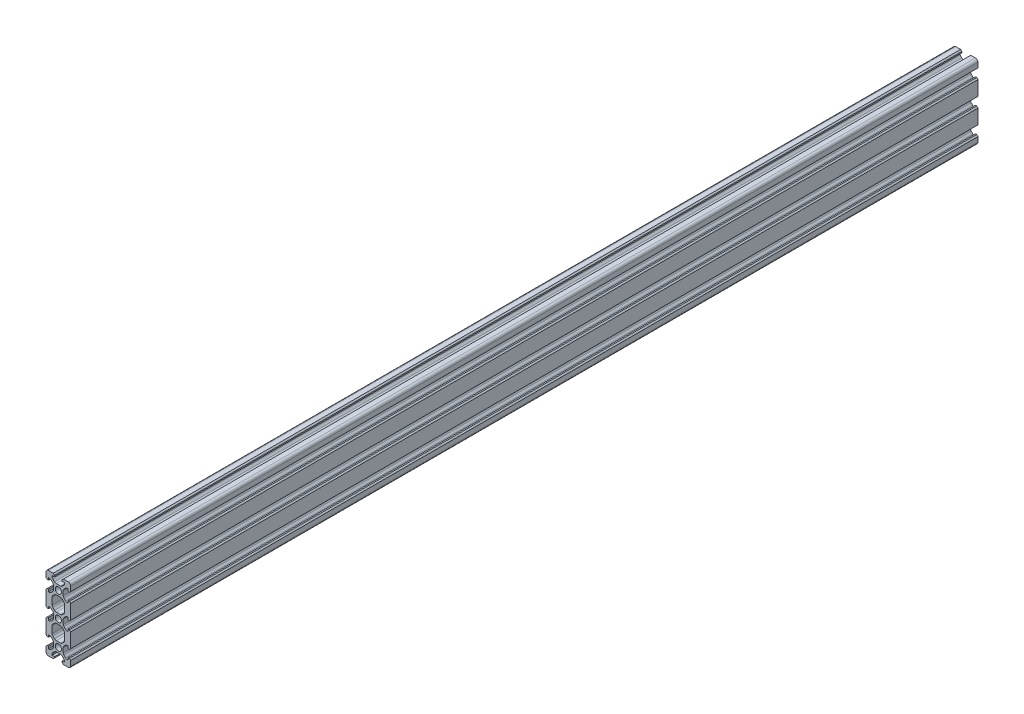
from build123d import *

# Parameters (mm, degrees)
SKETCH1_R           = 2.5
BOSS_EXTRUDE1_DEPTH = 735


with BuildPart() as part:
    # Sketch1 → Boss-Extrude1 (new body)
    with BuildSketch(Plane.XY):
        with BuildLine():
            Line((3.1, 29), (4.1, 30))
            Line((4.1, 30), (8, 30))
            ThreePointArc((8, 30), (9.414213562, 29.414213562), (10, 28))
            Line((10, 28), (10, 24.1))
            Line((10, 24.1), (9, 23.1))
            Line((9, 23.1), (8, 23.1))
            Line((8, 23.1), (8, 25))
            Line((8, 25), (7.242640687, 25))
            ThreePointArc((7.242640687, 25), (6.477273822, 24.847759065), (5.828427125, 24.414213562))
            Line((5.828427125, 24.414213562), (4.537854624, 23.123641061))
            ThreePointArc((4.537854624, 23.123641061), (4.104309121, 22.474794364), (3.952068186, 21.709427499))
            Line((3.952068186, 21.709427499), (3.952068186, 18.290572501))
            ThreePointArc((3.952068186, 18.290572501), (4.104309121, 17.525205636), (4.537854624, 16.876358939))
            Line((4.537854624, 16.876358939), (5.828427125, 15.585786438))
            ThreePointArc((5.828427125, 15.585786438), (6.477273822, 15.152240935), (7.242640687, 15))
            Line((7.242640687, 15), (8, 15))
            Line((8, 15), (8, 16.9))
            Line((8, 16.9), (9, 16.9))
            Line((9, 16.9), (10, 15.9))
            Line((10, 15.9), (10, 4.1))
            Line((10, 4.1), (9, 3.1))
            Line((9, 3.1), (8, 3.1))
            Line((8, 3.1), (8, 5))
            Line((8, 5), (7.242640687, 5))
            ThreePointArc((7.242640687, 5), (6.477273822, 4.847759065), (5.828427125, 4.414213562))
            Line((5.828427125, 4.414213562), (4.537854624, 3.123641061))
            ThreePointArc((4.537854624, 3.123641061), (4.104309121, 2.474794364), (3.952068186, 1.709427499))
            Line((3.952068186, 1.709427499), (3.952068186, -1.709427499))
            ThreePointArc((3.952068186, -1.709427499), (4.104309121, -2.474794364), (4.537854624, -3.123641061))
            Line((4.537854624, -3.123641061), (5.828427125, -4.414213562))
            ThreePointArc((5.828427125, -4.414213562), (6.477273822, -4.847759065), (7.242640687, -5))
            Line((7.242640687, -5), (8, -5))
            Line((8, -5), (8, -3.1))
            Line((8, -3.1), (9, -3.1))
            Line((9, -3.1), (10, -4.1))
            Line((10, -4.1), (10, -15.9))
            Line((10, -15.9), (9, -16.9))
            Line((9, -16.9), (8, -16.9))
            Line((8, -16.9), (8, -15))
            Line((8, -15), (7.242640687, -15))
            ThreePointArc((7.242640687, -15), (6.477273822, -15.152240935), (5.828427125, -15.585786438))
            Line((5.828427125, -15.585786438), (4.537854624, -16.876358939))
            ThreePointArc((4.537854624, -16.876358939), (4.104309121, -17.525205636), (3.952068186, -18.290572501))
            Line((3.952068186, -18.290572501), (3.952068186, -21.709427499))
            ThreePointArc((3.952068186, -21.709427499), (4.104309121, -22.474794364), (4.537854624, -23.123641061))
            Line((4.537854624, -23.123641061), (5.828427125, -24.414213562))
            ThreePointArc((5.828427125, -24.414213562), (6.477273822, -24.847759065), (7.242640687, -25))
            Line((7.242640687, -25), (8, -25))
            Line((8, -25), (8, -23.1))
            Line((8, -23.1), (9, -23.1))
            Line((9, -23.1), (10, -24.1))
            Line((10, -24.1), (10, -28))
            ThreePointArc((10, -28), (9.414213562, -29.414213562), (8, -30))
            Line((8, -30), (4.1, -30))
            Line((4.1, -30), (3.1, -29))
            Line((3.1, -29), (3.1, -28))
            Line((3.1, -28), (5, -28))
            Line((5, -28), (5, -27.242640687))
            ThreePointArc((5, -27.242640687), (4.847759065, -26.477273822), (4.414213562, -25.828427125))
            Line((4.414213562, -25.828427125), (3.123641061, -24.537854624))
            ThreePointArc((3.123641061, -24.537854624), (2.474794364, -24.104309121), (1.709427499, -23.952068186))
            Line((1.709427499, -23.952068186), (-1.709427499, -23.952068186))
            ThreePointArc((-1.709427499, -23.952068186), (-2.474794364, -24.104309121), (-3.123641061, -24.537854624))
            Line((-3.123641061, -24.537854624), (-4.414213562, -25.828427125))
            ThreePointArc((-4.414213562, -25.828427125), (-4.847759065, -26.477273822), (-5, -27.242640687))
            Line((-5, -27.242640687), (-5, -28))
            Line((-5, -28), (-3.1, -28))
            Line((-3.1, -28), (-3.1, -29))
            Line((-3.1, -29), (-4.1, -30))
            Line((-4.1, -30), (-8, -30))
            ThreePointArc((-8, -30), (-9.414213562, -29.414213562), (-10, -28))
            Line((-10, -28), (-10, -24.1))
            Line((-10, -24.1), (-9, -23.1))
            Line((-9, -23.1), (-8, -23.1))
            Line((-8, -23.1), (-8, -25))
            Line((-8, -25), (-7.242640687, -25))
            ThreePointArc((-7.242640687, -25), (-6.477273822, -24.847759065), (-5.828427125, -24.414213562))
            Line((-5.828427125, -24.414213562), (-4.537854624, -23.123641061))
            ThreePointArc((-4.537854624, -23.123641061), (-4.104309121, -22.474794364), (-3.952068186, -21.709427499))
            Line((-3.952068186, -21.709427499), (-3.952068186, -18.290572501))
            ThreePointArc((-3.952068186, -18.290572501), (-4.104309121, -17.525205636), (-4.537854624, -16.876358939))
            Line((-4.537854624, -16.876358939), (-5.828427125, -15.585786438))
            ThreePointArc((-5.828427125, -15.585786438), (-6.477273822, -15.152240935), (-7.242640687, -15))
            Line((-7.242640687, -15), (-8, -15))
            Line((-8, -15), (-8, -16.9))
            Line((-8, -16.9), (-9, -16.9))
            Line((-9, -16.9), (-10, -15.9))
            Line((-10, -15.9), (-10, -4.1))
            Line((-10, -4.1), (-9, -3.1))
            Line((-9, -3.1), (-8, -3.1))
            Line((-8, -3.1), (-8, -5))
            Line((-8, -5), (-7.242640687, -5))
            ThreePointArc((-7.242640687, -5), (-6.477273822, -4.847759065), (-5.828427125, -4.414213562))
            Line((-5.828427125, -4.414213562), (-4.537854624, -3.123641061))
            ThreePointArc((-4.537854624, -3.123641061), (-4.104309121, -2.474794364), (-3.952068186, -1.709427499))
            Line((-3.952068186, -1.709427499), (-3.952068186, 1.709427499))
            ThreePointArc((-3.952068186, 1.709427499), (-4.104309121, 2.474794364), (-4.537854624, 3.123641061))
            Line((-4.537854624, 3.123641061), (-5.828427125, 4.414213562))
            ThreePointArc((-5.828427125, 4.414213562), (-6.477273822, 4.847759065), (-7.242640687, 5))
            Line((-7.242640687, 5), (-8, 5))
            Line((-8, 5), (-8, 3.1))
            Line((-8, 3.1), (-9, 3.1))
            Line((-9, 3.1), (-10, 4.1))
            Line((-10, 4.1), (-10, 15.9))
            Line((-10, 15.9), (-9, 16.9))
            Line((-9, 16.9), (-8, 16.9))
            Line((-8, 16.9), (-8, 15))
            Line((-8, 15), (-7.242640687, 15))
            ThreePointArc((-7.242640687, 15), (-6.477273822, 15.152240935), (-5.828427125, 15.585786438))
            Line((-5.828427125, 15.585786438), (-4.537854624, 16.876358939))
            ThreePointArc((-4.537854624, 16.876358939), (-4.104309121, 17.525205636), (-3.952068186, 18.290572501))
            Line((-3.952068186, 18.290572501), (-3.952068186, 21.709427499))
            ThreePointArc((-3.952068186, 21.709427499), (-4.104309121, 22.474794364), (-4.537854624, 23.123641061))
            Line((-4.537854624, 23.123641061), (-5.828427125, 24.414213562))
            ThreePointArc((-5.828427125, 24.414213562), (-6.477273822, 24.847759065), (-7.242640687, 25))
            Line((-7.242640687, 25), (-8, 25))
            Line((-8, 25), (-8, 23.1))
            Line((-8, 23.1), (-9, 23.1))
            Line((-9, 23.1), (-10, 24.1))
            Line((-10, 24.1), (-10, 28))
            ThreePointArc((-10, 28), (-9.414213562, 29.414213562), (-8, 30))
            Line((-8, 30), (-4.1, 30))
            Line((-4.1, 30), (-3.1, 29))
            Line((-3.1, 29), (-3.1, 28))
            Line((-3.1, 28), (-5, 28))
            Line((-5, 28), (-5, 27.242640687))
            ThreePointArc((-5, 27.242640687), (-4.847759065, 26.477273822), (-4.414213562, 25.828427125))
            Line((-4.414213562, 25.828427125), (-3.123641061, 24.537854624))
            ThreePointArc((-3.123641061, 24.537854624), (-2.474794364, 24.104309121), (-1.709427499, 23.952068186))
            Line((-1.709427499, 23.952068186), (1.709427499, 23.952068186))
            ThreePointArc((1.709427499, 23.952068186), (2.474794364, 24.104309121), (3.123641061, 24.537854624))
            Line((3.123641061, 24.537854624), (4.414213562, 25.828427125))
            ThreePointArc((4.414213562, 25.828427125), (4.847759065, 26.477273822), (5, 27.242640687))
            Line((5, 27.242640687), (5, 28))
            Line((5, 28), (3.1, 28))
            Line((3.1, 28), (3.1, 29))
        make_face()
        with Locations((0, -20)):
            Circle(SKETCH1_R, mode=Mode.SUBTRACT)
        Circle(SKETCH1_R, mode=Mode.SUBTRACT)
        with Locations((0, 20)):
            Circle(SKETCH1_R, mode=Mode.SUBTRACT)
        with BuildLine():
            Line((4.414213562, -14.171572875), (3.123641061, -15.462145376))
            ThreePointArc((3.123641061, -15.462145376), (2.474794364, -15.895690879), (1.709427499, -16.047931814))
            Line((1.709427499, -16.047931814), (-1.709427499, -16.047931814))
            ThreePointArc((-1.709427499, -16.047931814), (-2.474794364, -15.895690879), (-3.123641061, -15.462145376))
            Line((-3.123641061, -15.462145376), (-4.414213562, -14.171572875))
            ThreePointArc((-4.414213562, -14.171572875), (-4.847759065, -13.522726178), (-5, -12.757359313))
            Line((-5, -12.757359313), (-5, -7.242640687))
            ThreePointArc((-5, -7.242640687), (-4.847759065, -6.477273822), (-4.414213562, -5.828427125))
            Line((-4.414213562, -5.828427125), (-3.123641061, -4.537854624))
            ThreePointArc((-3.123641061, -4.537854624), (-2.474794364, -4.104309121), (-1.709427499, -3.952068186))
            Line((-1.709427499, -3.952068186), (1.709427499, -3.952068186))
            ThreePointArc((1.709427499, -3.952068186), (2.474794364, -4.104309121), (3.123641061, -4.537854624))
            Line((3.123641061, -4.537854624), (4.414213562, -5.828427125))
            ThreePointArc((4.414213562, -5.828427125), (4.847759065, -6.477273822), (5, -7.242640687))
            Line((5, -7.242640687), (5, -12.757359313))
            ThreePointArc((5, -12.757359313), (4.847759065, -13.522726178), (4.414213562, -14.171572875))
        make_face(mode=Mode.SUBTRACT)
        with BuildLine():
            Line((5, 7.242640687), (5, 12.757359313))
            ThreePointArc((5, 12.757359313), (4.847759065, 13.522726178), (4.414213562, 14.171572875))
            Line((4.414213562, 14.171572875), (3.123641061, 15.462145376))
            ThreePointArc((3.123641061, 15.462145376), (2.474794364, 15.895690879), (1.709427499, 16.047931814))
            Line((1.709427499, 16.047931814), (-1.709427499, 16.047931814))
            ThreePointArc((-1.709427499, 16.047931814), (-2.474794364, 15.895690879), (-3.123641061, 15.462145376))
            Line((-3.123641061, 15.462145376), (-4.414213562, 14.171572875))
            ThreePointArc((-4.414213562, 14.171572875), (-4.847759065, 13.522726178), (-5, 12.757359313))
            Line((-5, 12.757359313), (-5, 7.242640687))
            ThreePointArc((-5, 7.242640687), (-4.847759065, 6.477273822), (-4.414213562, 5.828427125))
            Line((-4.414213562, 5.828427125), (-3.123641061, 4.537854624))
            ThreePointArc((-3.123641061, 4.537854624), (-2.474794364, 4.104309121), (-1.709427499, 3.952068186))
            Line((-1.709427499, 3.952068186), (1.709427499, 3.952068186))
            ThreePointArc((1.709427499, 3.952068186), (2.474794364, 4.104309121), (3.123641061, 4.537854624))
            Line((3.123641061, 4.537854624), (4.414213562, 5.828427125))
            ThreePointArc((4.414213562, 5.828427125), (4.847759065, 6.477273822), (5, 7.242640687))
        make_face(mode=Mode.SUBTRACT)
    extrude(amount=BOSS_EXTRUDE1_DEPTH)


solid = part.part
